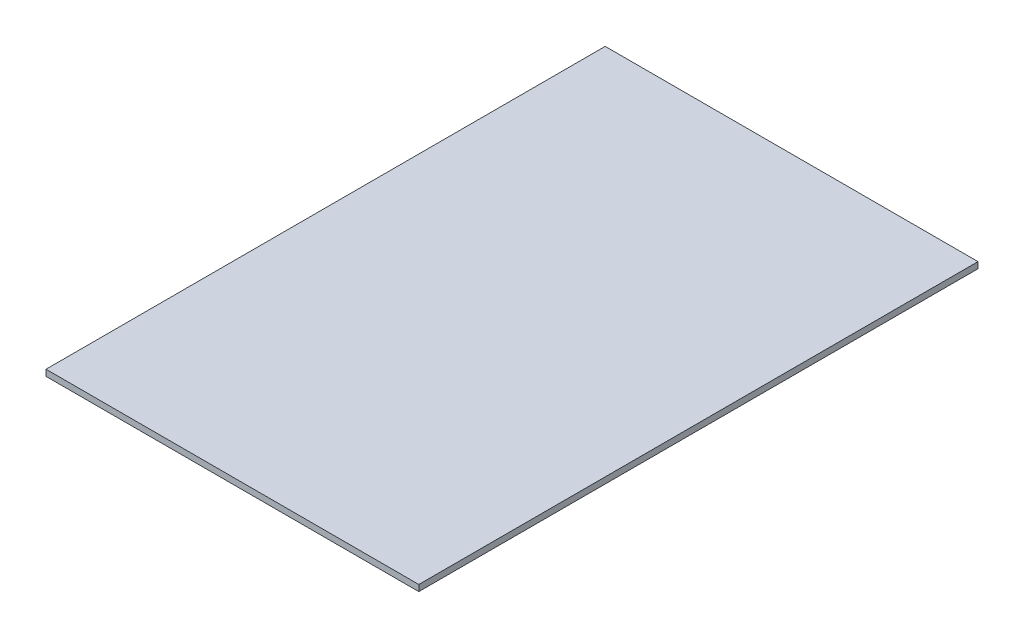
from build123d import *

# Parameters (mm, degrees)
SKETCH1_W           = 120
SKETCH1_H           = 180
BOSS_EXTRUDE1_DEPTH = 2


with BuildPart() as part:
    # Sketch1 → Boss-Extrude1 (new body)
    with BuildSketch(Plane(origin=(0, 0, 0), x_dir=(1, 0, 0), z_dir=(0, 1, 0))):
        Rectangle(SKETCH1_W, SKETCH1_H)
    extrude(amount=BOSS_EXTRUDE1_DEPTH)


solid = part.part
